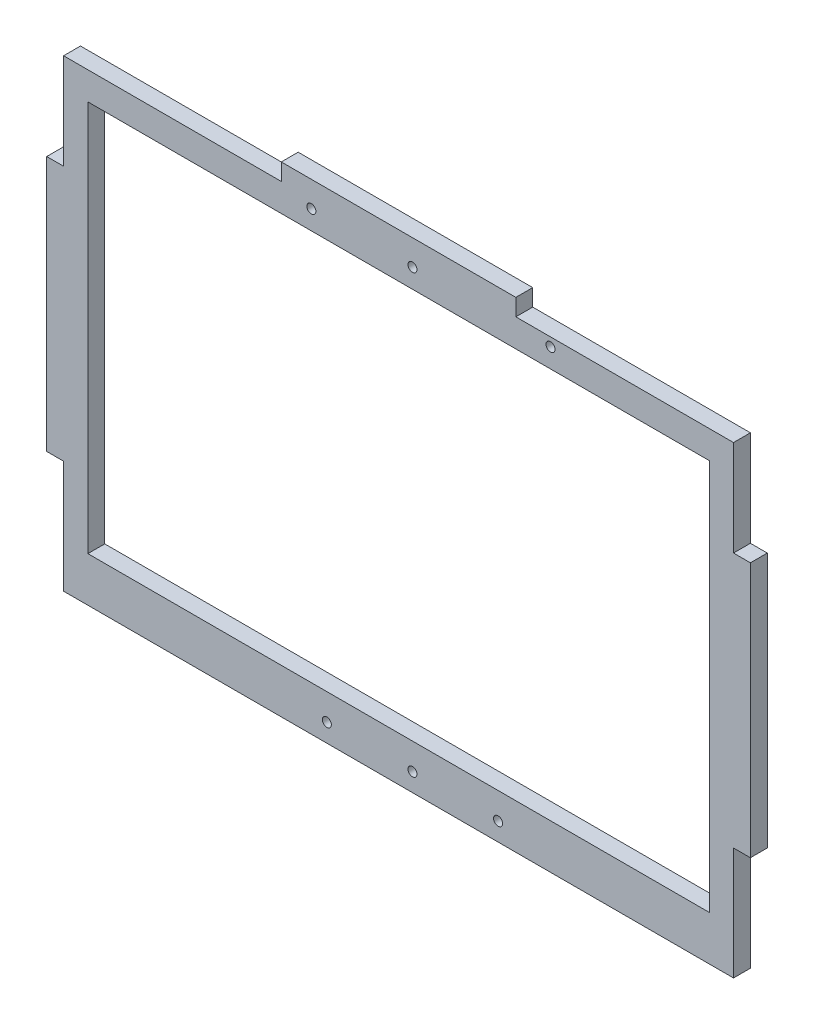
from build123d import *

# Parameters (mm, degrees)
SKETCH1_W            = 500
SKETCH1_H            = 341.5
BOSS_EXTRUDE1_DEPTH  = 12
SKETCH5_W            = 12
SKETCH5_H            = 80
CUT_EXTRUDE2_DEPTH   = 606.612293468
SKETCH3_W            = 441.52
SKETCH3_H            = 278
CUT_EXTRUDE3_DEPTH   = 606.612293468
SKETCH6_W            = 154.666666667
SKETCH6_H            = 12
CUT_EXTRUDE4_DEPTH   = 606.612293468
SCALE1_SCALE         = 0.5
M3_CLEARANCE_SLOT1_D = 3.2
M3_CLEARANCE_SLOT2_D = 3.2


with BuildPart() as part:
    # Sketch1 → Boss-Extrude1 (new body)
    with BuildSketch(Plane.XY):
        with Locations((250, 170.75)):
            Rectangle(SKETCH1_W, SKETCH1_H)
    extrude(amount=BOSS_EXTRUDE1_DEPTH)

    # Sketch5 → Cut-Extrude2 (cut, through all)
    with BuildSketch(Plane.XY.offset(12)):
        with Locations((6, 301.5)):
            Rectangle(SKETCH5_W, SKETCH5_H)
        with Locations((6, 40)):
            Rectangle(SKETCH5_W, SKETCH5_H)
        with Locations((494, 301.5)):
            Rectangle(SKETCH5_W, SKETCH5_H)
        with Locations((494, 40)):
            Rectangle(SKETCH5_W, SKETCH5_H)
    extrude(amount=-CUT_EXTRUDE2_DEPTH, mode=Mode.SUBTRACT)

    # Sketch3 → Cut-Extrude3 (cut, through all)
    with BuildSketch(Plane.XY.offset(12)):
        with Locations((250, 170.75)):
            Rectangle(SKETCH3_W, SKETCH3_H)
    extrude(amount=-CUT_EXTRUDE3_DEPTH, mode=Mode.SUBTRACT)

    # Sketch6 → Cut-Extrude4 (cut, through all)
    with BuildSketch(Plane.XY.offset(12)):
        with Locations((410.666666667, 335.5)):
            Rectangle(SKETCH6_W, SKETCH6_H)
        with Locations((89.333333334, 335.5)):
            Rectangle(SKETCH6_W, SKETCH6_H)
    extrude(amount=-CUT_EXTRUDE4_DEPTH, mode=Mode.SUBTRACT)


with BuildPart() as part_1:
    # Scale1: scaled about (250, 155.633318535, 6)
    add(part.part.scale(SCALE1_SCALE).moved(Location((125, 77.816659268, 3))))

    # M3 Clearance Slot1 (through all)
    with Locations(Plane.XY.offset(9)):
        with Locations((219.02, 239.491659268), (303.98, 239.491659268), (224.52, 84.291659268), (285.36, 84.291659268)):
            Hole(M3_CLEARANCE_SLOT1_D / 2)

    # M3 Clearance Slot2 (through all)
    with Locations(Plane.XY.offset(9)):
        with Locations((254.94, 84.296659268), (254.94, 239.491659268)):
            Hole(M3_CLEARANCE_SLOT2_D / 2)


solid = part_1.part
